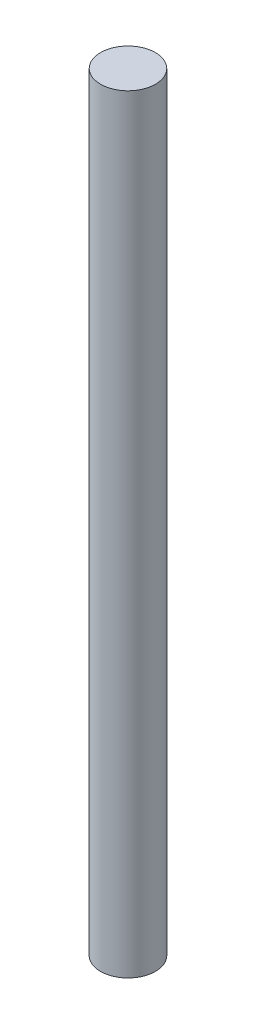
from build123d import *

# Parameters (mm, degrees)
CROQUIS1_R              = 4
SALIENTE_EXTRUIR1_DEPTH = 112


with BuildPart() as part:
    # Croquis1 → Saliente-Extruir1 (new body)
    with BuildSketch(Plane(origin=(0, 0, 0), x_dir=(1, 0, 0), z_dir=(0, 1, 0))):
        with Locations(Location((0, 0, 0), (0, 0, 270))):
            Circle(CROQUIS1_R)
    extrude(amount=SALIENTE_EXTRUIR1_DEPTH)


solid = part.part
